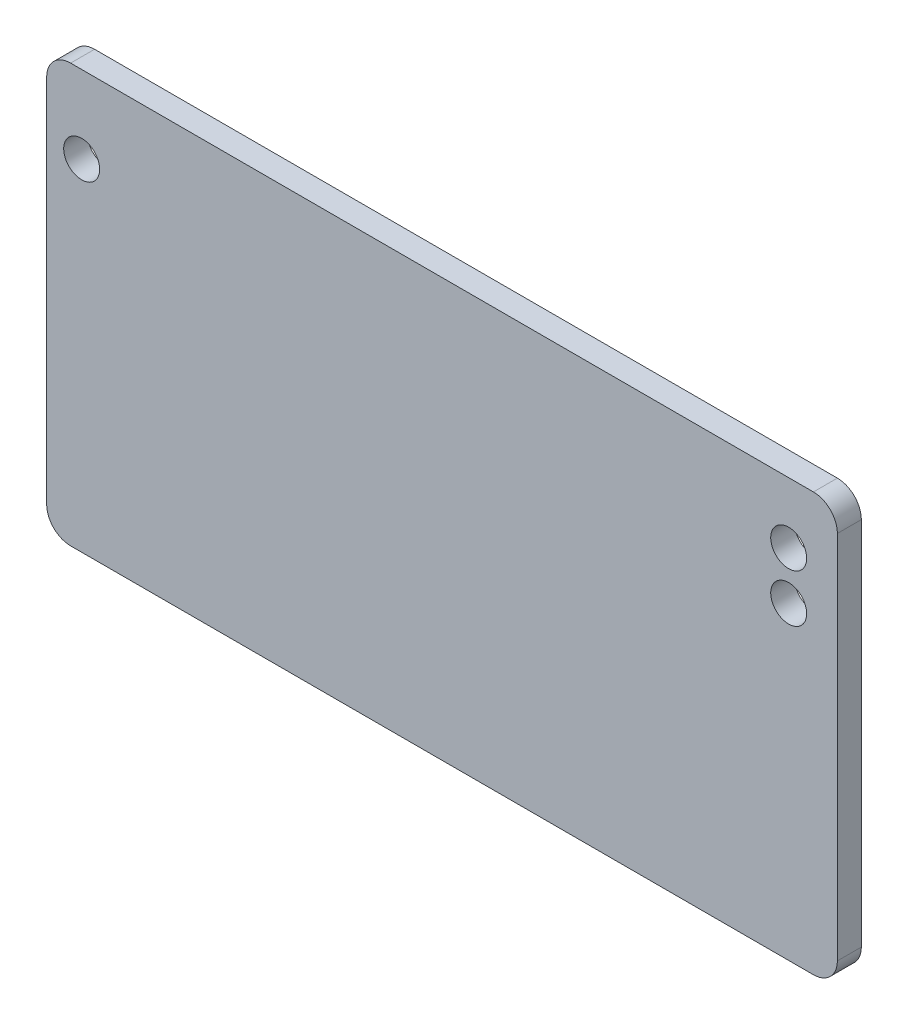
from build123d import *

# Parameters (mm, degrees)
EXTRUDE_1_DEPTH     = 2
SKETCH_2_R          = 1.5
CUT_EXTRUDE_1_DEPTH = 3


with BuildPart() as part:
    # 草图1 → 凸台-拉伸1 (new body)
    with BuildSketch(Plane.XY):
        with BuildLine():
            Line((-30.093969849, 14.036762938), (31.906030151, 14.036762938))
            ThreePointArc((31.906030151, 14.036762938), (33.320243713, 13.4509765), (33.906030151, 12.036762938))
            Line((33.906030151, 12.036762938), (33.906030151, -18.863237062))
            ThreePointArc((33.906030151, -18.863237062), (33.320243713, -20.277450625), (31.906030151, -20.863237062))
            Line((31.906030151, -20.863237062), (-30.093969849, -20.863237062))
            ThreePointArc((-30.093969849, -20.863237062), (-31.508183412, -20.277450625), (-32.093969849, -18.863237062))
            Line((-32.093969849, -18.863237062), (-32.093969849, 12.036762938))
            ThreePointArc((-32.093969849, 12.036762938), (-31.508183412, 13.4509765), (-30.093969849, 14.036762938))
        make_face()
    extrude(amount=EXTRUDE_1_DEPTH)

    # 草图2 → 切除-拉伸1 (cut)
    with BuildSketch(Plane.XY.offset(2)):
        with Locations((-29.172969849, 7.559762938)):
            Circle(SKETCH_2_R)
        with Locations((29.842030151, 8.956762938)):
            Circle(SKETCH_2_R)
        with Locations((29.842030151, 4.956762938)):
            Circle(SKETCH_2_R)
    extrude(amount=-CUT_EXTRUDE_1_DEPTH, mode=Mode.SUBTRACT)


solid = part.part
